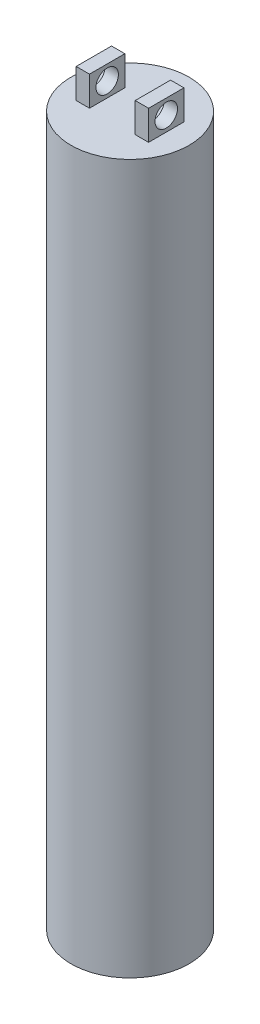
from build123d import *

# Parameters (mm, degrees)
SKETCH1_R           = 25.4
BOSS_EXTRUDE1_DEPTH = 304.8
SKETCH3_W           = 5.753643288
SKETCH3_H           = 15.213425176
SKETCH3_W_2         = 5.733174908
BOSS_EXTRUDE2_DEPTH = 12.7
CUT_EXTRUDE2_DEPTH  = 62.738
SKETCH6_R           = 4.7625
CUT_EXTRUDE3_DEPTH  = 2.54


with BuildPart() as part:
    # Sketch1 → Boss-Extrude1 (new body)
    with BuildSketch(Plane(origin=(0, 0, 0), x_dir=(1, 0, 0), z_dir=(0, 1, 0))):
        with Locations(Location((0, 0, 0), (0, 0, 90))):
            Circle(SKETCH1_R)
    extrude(amount=BOSS_EXTRUDE1_DEPTH)

    # Sketch3 → Boss-Extrude2 (add)
    with BuildSketch(Plane(origin=(0, 304.8, 0), x_dir=(1, 0, 0), z_dir=(0, 1, 0))):
        with Locations((12.7, 0)):
            Rectangle(SKETCH3_W, SKETCH3_H)
        with Locations((-12.7, 0)):
            Rectangle(SKETCH3_W_2, SKETCH3_H)
    extrude(amount=BOSS_EXTRUDE2_DEPTH)

    # Sketch4 → Cut-Extrude2 (cut)
    with BuildSketch(Plane(origin=(15.576821644, 0, 0), x_dir=(0, 0, -1), z_dir=(1, 0, 0))):
        with BuildLine():
            ThreePointArc((4.826, 311.15), (3.412497326, 314.562497326), (0, 315.976))
            Line((0, 315.976), (0, 306.324))
            ThreePointArc((0, 306.324), (3.412497326, 307.737502674), (4.826, 311.15))
        make_face()
        with BuildLine():
            Line((0, 306.324), (0, 315.976))
            ThreePointArc((0, 315.976), (-4.826, 311.15), (0, 306.324))
        make_face()
    extrude(amount=-CUT_EXTRUDE2_DEPTH, mode=Mode.SUBTRACT)

    # Sketch6 → Cut-Extrude3 (cut)
    with BuildSketch(Plane.XZ):
        with Locations(Location((-12.7, 0, 0), (0, 0, 270))):
            Circle(SKETCH6_R)
        with Locations(Location((12.7, 0, 0), (0, 0, 270))):
            Circle(SKETCH6_R)
    extrude(amount=-CUT_EXTRUDE3_DEPTH, mode=Mode.SUBTRACT)


solid = part.part
